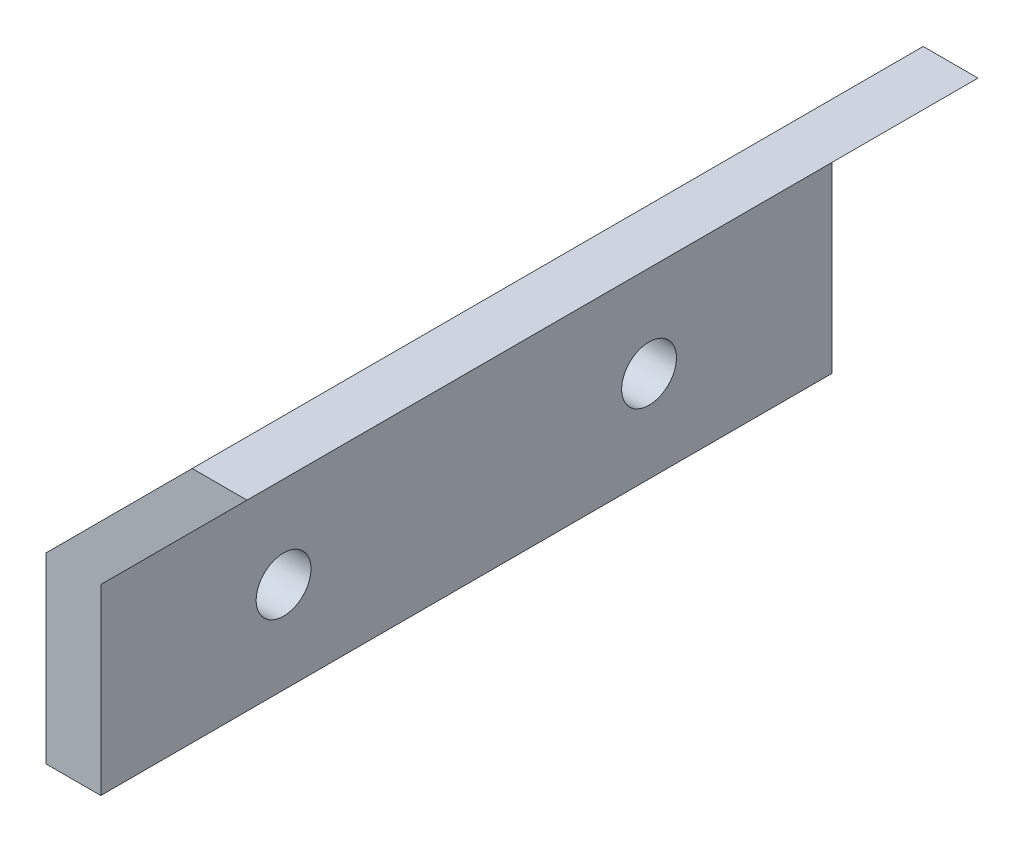
from build123d import *

# Parameters (mm, degrees)
EXTRUDE_2_DEPTH     = 40
SKETCH_3_R          = 1.5
CUT_EXTRUDE_1_DEPTH = 10
SKETCH_4_R          = 1.686195938
SKETCH_4_R_2        = 1.862668349
CUT_EXTRUDE_2_DEPTH = 10


with BuildPart() as part:
    # 草图2 → 凸台-拉伸2 (new body)
    with BuildSketch(Plane.XY):
        Polygon((0, 0), (0, 10), (8, 18), (11, 18), (3, 10), (3, 0), align=None)
    extrude(amount=EXTRUDE_2_DEPTH)

    # 草图3 → 切除-拉伸1 (cut)
    with BuildSketch(Plane(origin=(3, 0, 0), x_dir=(0, 0, -1), z_dir=(1, 0, 0))):
        with Locations(Location((-10, 5, 0), (0, 0, 90))):
            Circle(SKETCH_3_R)
        with Locations(Location((-30, 5, 0), (0, 0, 90))):
            Circle(SKETCH_3_R)
    extrude(amount=-CUT_EXTRUDE_1_DEPTH, mode=Mode.SUBTRACT)

    # 草图4 → 切除-拉伸2 (cut)
    with BuildSketch(Plane(origin=(-3.5, 3.5, 0), x_dir=(0, 0, -1), z_dir=(0.7071067811865515, -0.7071067811865437, 0))):
        with Locations(Location((-7, 15.192388155, 0), (0, 0, 90))):
            Circle(SKETCH_4_R)
        with Locations(Location((-33, 15.192388155, 0), (0, 0, 90))):
            Circle(SKETCH_4_R_2)
    extrude(amount=-CUT_EXTRUDE_2_DEPTH, mode=Mode.SUBTRACT)


solid = part.part
